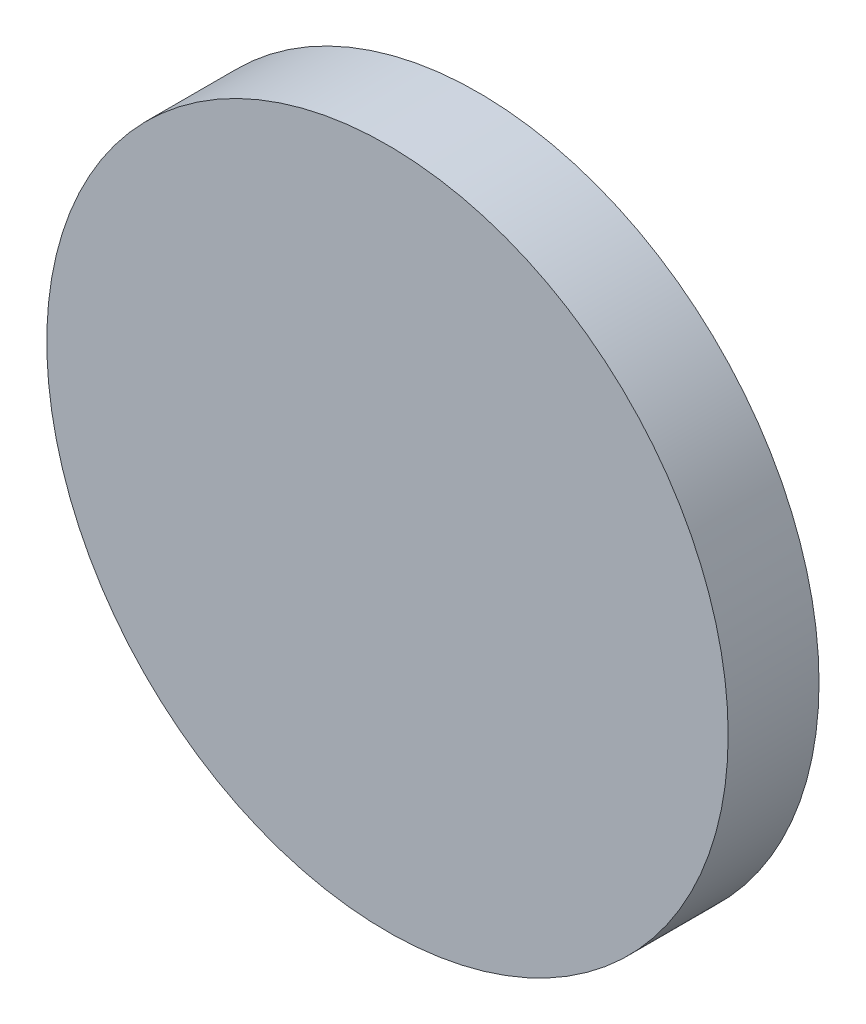
from build123d import *

# Parameters (mm, degrees)
SKETCH_1_R      = 4.5
SKETCH_1_R_2    = 3.5
EXTRUDE_1_DEPTH = 2
SKETCH_2_R      = 7.5
EXTRUDE_2_DEPTH = 2


with BuildPart() as part:
    # 草图1 → 凸台-拉伸1 (new body)
    with BuildSketch(Plane.XY):
        Circle(SKETCH_1_R)
        Circle(SKETCH_1_R_2, mode=Mode.SUBTRACT)
    extrude(amount=EXTRUDE_1_DEPTH)

    # 草图2 → 凸台-拉伸2 (add)
    with BuildSketch(Plane.XY.offset(2)):
        Circle(SKETCH_2_R)
    extrude(amount=EXTRUDE_2_DEPTH)


solid = part.part
